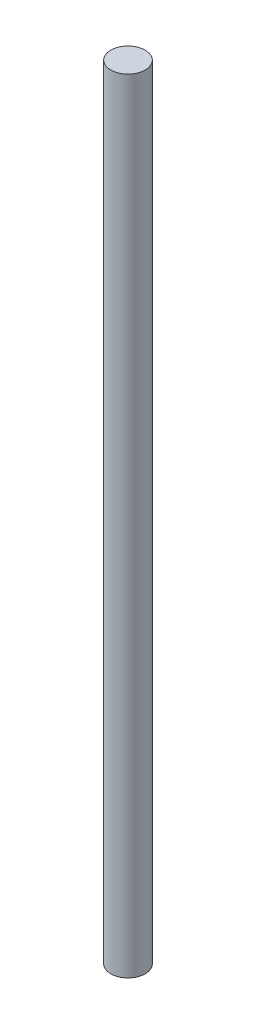
from build123d import *

# Parameters (mm, degrees)
SKETCH1_R           = 6.6
BOSS_EXTRUDE1_DEPTH = 300


with BuildPart() as part:
    # Sketch1 → Boss-Extrude1 (new body)
    with BuildSketch(Plane(origin=(0, 0, 0), x_dir=(1, 0, 0), z_dir=(0, 1, 0))):
        with Locations(Location((-80.355907069, 42.454704235, 0), (0, 0, 270))):
            Circle(SKETCH1_R)
    extrude(amount=BOSS_EXTRUDE1_DEPTH)


solid = part.part
